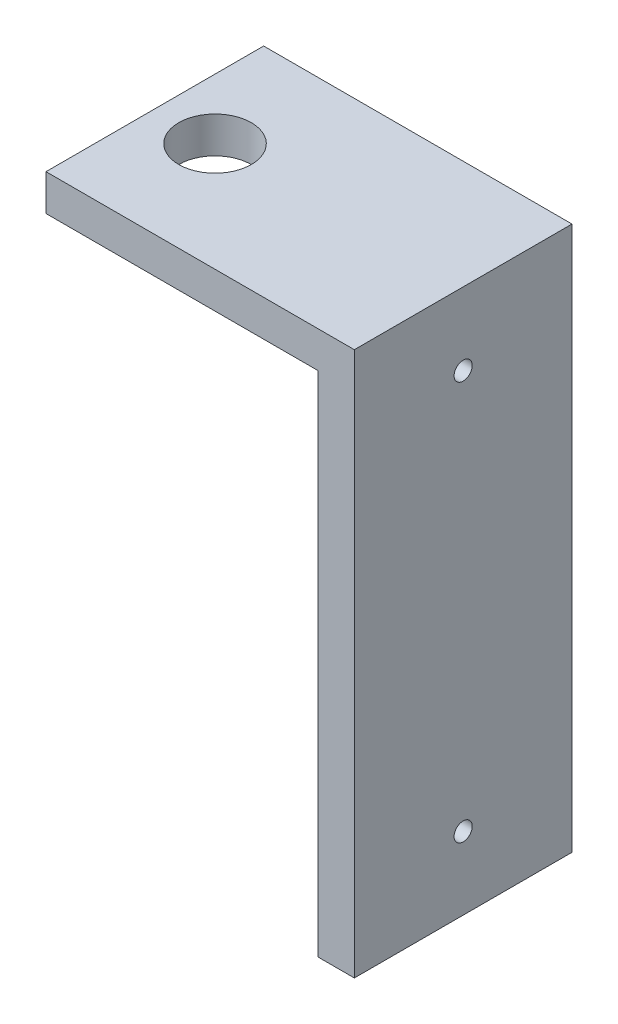
from build123d import *

# Parameters (mm, degrees)
BOSS_EXTRUDE1_DEPTH = 6
SKETCH2_R           = 2
CUT_EXTRUDE1_DEPTH  = 10
CUT_EXTRUDE2_REACH  = 28.579
SKETCH3_R           = 0.5


with BuildPart() as part:
    # Sketch1 → Boss-Extrude1 (new, symmetric)
    with BuildSketch(Plane.XY):
        Polygon((8.63397831, 8.469387755), (23.63397831, 8.469387755), (23.63397831, -19.530612245), (25.63397831, -19.530612245), (25.63397831, 10.469387755), (8.63397831, 10.469387755), align=None)
    extrude(amount=BOSS_EXTRUDE1_DEPTH, both=True)

    # Sketch2 → Cut-Extrude1 (cut)
    with BuildSketch(Plane(origin=(0, 10.469387755, 0), x_dir=(1, 0, 0), z_dir=(0, 1, 0))):
        with Locations(Location((11.953216886, 0, 0), (0, 0, 180))):
            Circle(SKETCH2_R)
    extrude(amount=-CUT_EXTRUDE1_DEPTH, mode=Mode.SUBTRACT)

    # Sketch3 → Cut-Extrude2 (cut, up to next)
    with BuildSketch(Plane(origin=(25.63397831, 0, 0), x_dir=(0, 0, -1), z_dir=(1, 0, 0)), mode=Mode.PRIVATE) as cut_extrude2_sk1:
        with Locations((0, -15.530612245)):
            Circle(SKETCH3_R)
    cut_extrude2_tool1 = extrude(cut_extrude2_sk1.sketch, amount=-CUT_EXTRUDE2_REACH, mode=Mode.PRIVATE) & part.part
    # Sketch3 → Cut-Extrude2 (cut, up to next)
    with BuildSketch(Plane(origin=(25.63397831, 0, 0), x_dir=(0, 0, -1), z_dir=(1, 0, 0)), mode=Mode.PRIVATE) as cut_extrude2_sk2:
        with Locations((0, 6.469387755)):
            Circle(SKETCH3_R)
    cut_extrude2_tool2 = extrude(cut_extrude2_sk2.sketch, amount=-CUT_EXTRUDE2_REACH, mode=Mode.PRIVATE) & part.part
    add(cut_extrude2_tool1.solids().sort_by_distance((25.633978, -15.530612, 0))[0], mode=Mode.SUBTRACT)
    add(cut_extrude2_tool2.solids().sort_by_distance((25.633978, 6.469388, 0))[0], mode=Mode.SUBTRACT)


solid = part.part
